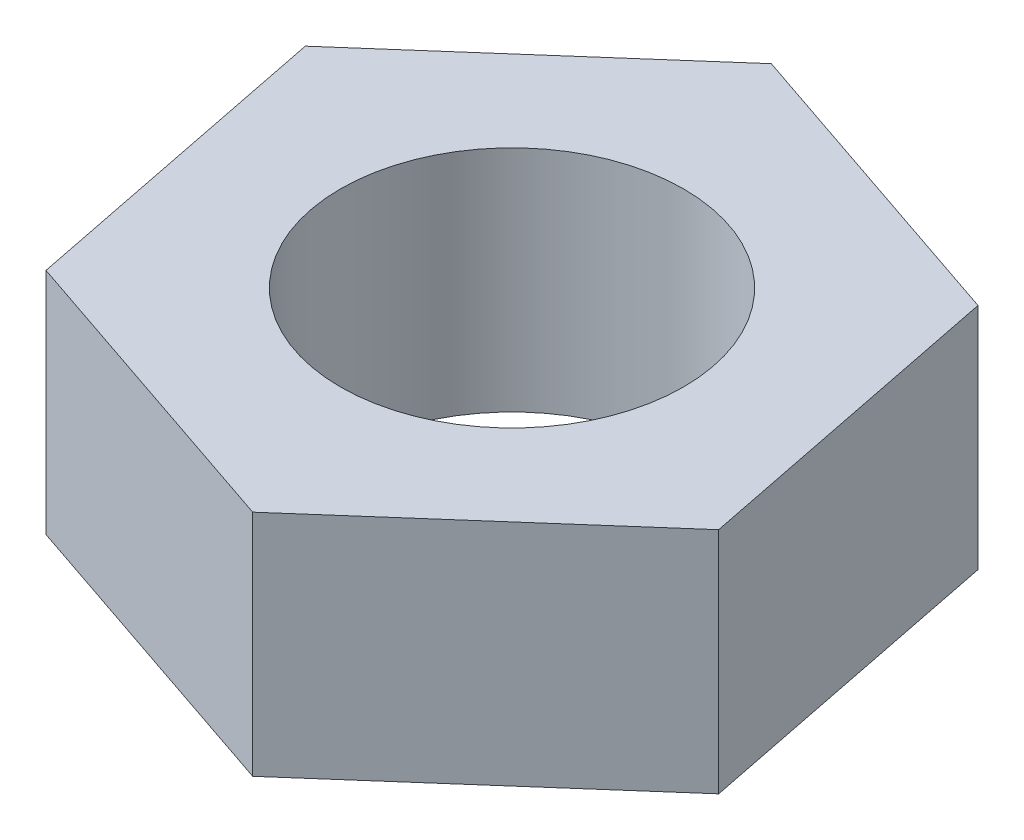
from build123d import *

# Parameters (mm, degrees)
SKETCH1_R           = 7.5
BOSS_EXTRUDE1_DEPTH = 10


with BuildPart() as part:
    # Sketch1 → Boss-Extrude1 (new body)
    with BuildSketch(Plane(origin=(0, 0, 0), x_dir=(1, 0, 0), z_dir=(0, 1, 0))):
        Polygon((10.848363311, 9.520837505), (-2.821105489, 14.15537697), (-13.669468801, 4.634539464), (-10.848363311, -9.520837505), (2.821105489, -14.15537697), (13.669468801, -4.634539464), align=None)
        with Locations(Location((0, 0, 0), (0, 0, 270))):
            Circle(SKETCH1_R, mode=Mode.SUBTRACT)
    extrude(amount=BOSS_EXTRUDE1_DEPTH)


solid = part.part
